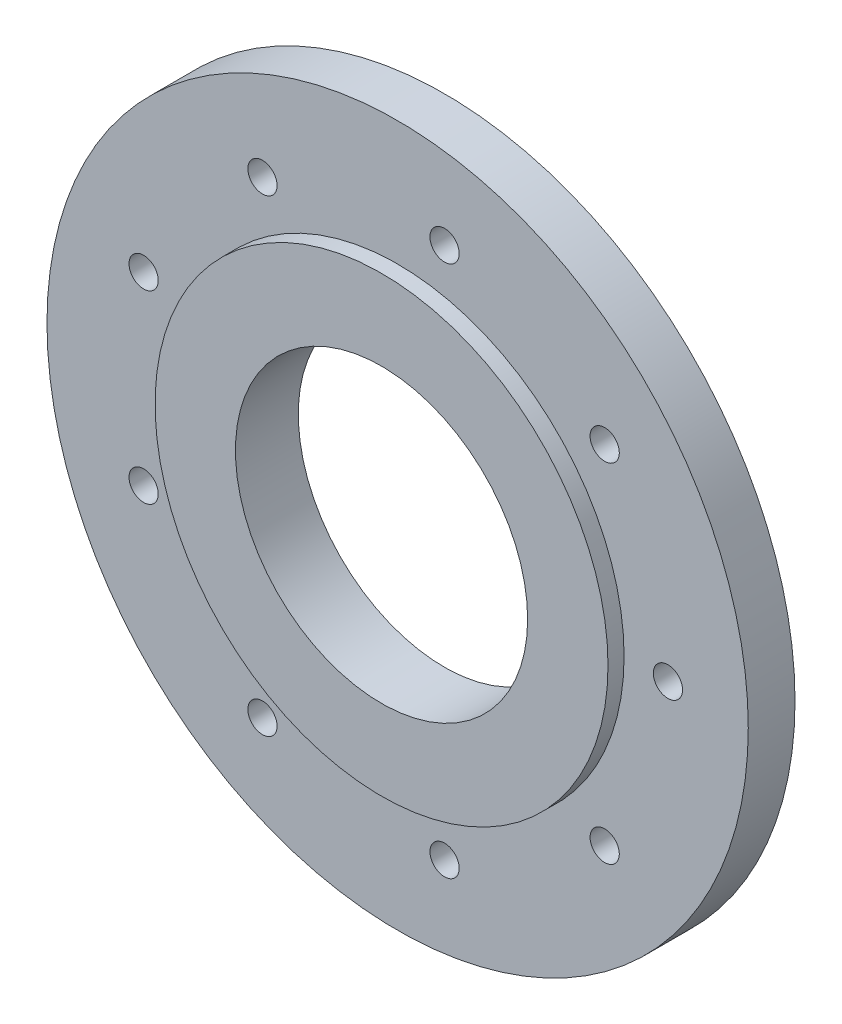
from build123d import *

# Parameters (mm, degrees)
SKETCH1_R           = 120
BOSS_EXTRUDE1_DEPTH = 21.5
SKETCH2_OUTSIDE_W   = 310.018
SKETCH2_OUTSIDE_H   = 310.018
SKETCH2_OUTSIDE_R   = 77.5
CUT_EXTRUDE1_DEPTH  = 5.5
SKETCH3_R           = 5
CUT_EXTRUDE2_DEPTH  = 171.458206021
CIRPATTERN1_COUNT   = 9
SKETCH4_R           = 50
CUT_EXTRUDE3_DEPTH  = 172.062123218


with BuildPart() as part:
    # Sketch1 → Boss-Extrude1 (new body)
    with BuildSketch(Plane.XY):
        Circle(SKETCH1_R)
    extrude(amount=BOSS_EXTRUDE1_DEPTH)

    # Sketch2 outside → Cut-Extrude1 (cut)
    with BuildSketch(Plane.XY.offset(21.5)):
        Rectangle(SKETCH2_OUTSIDE_W, SKETCH2_OUTSIDE_H)
        Circle(SKETCH2_OUTSIDE_R, mode=Mode.SUBTRACT)
    extrude(amount=-CUT_EXTRUDE1_DEPTH, mode=Mode.SUBTRACT)

    # Sketch3 → Cut-Extrude2 (cut, through all)
    with BuildSketch(Plane.XY.offset(16)):
        with Locations((92.5, 0)):
            Circle(SKETCH3_R)
    cut_extrude2 = extrude(amount=-CUT_EXTRUDE2_DEPTH, mode=Mode.SUBTRACT)

    # CirPattern1: Cut-Extrude2 ×9 about axis
    cirpattern1_axis = Axis((0, 0, 0), (0, 0, 1))
    for i in range(1, CIRPATTERN1_COUNT):
        add(cut_extrude2.rotate(cirpattern1_axis, i * 360 / CIRPATTERN1_COUNT), mode=Mode.SUBTRACT)

    # Sketch4 → Cut-Extrude3 (cut, through all)
    with BuildSketch(Plane.XY.offset(21.5)):
        Circle(SKETCH4_R)
    extrude(amount=-CUT_EXTRUDE3_DEPTH, mode=Mode.SUBTRACT)


solid = part.part
